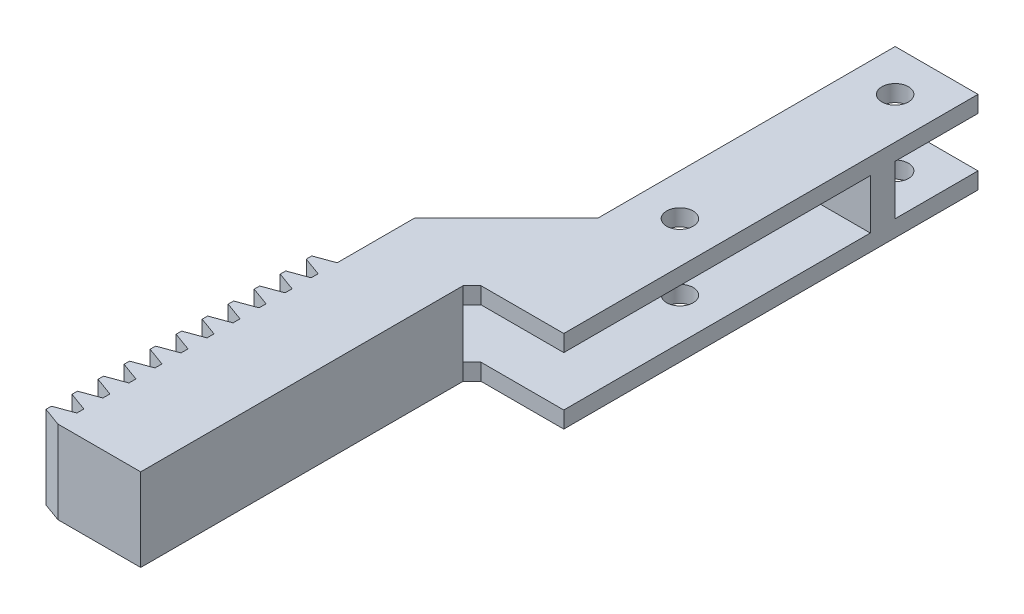
from build123d import *

# Parameters (mm, degrees)
SKETCH_1_W             = 10
SKETCH_1_H             = 50
EXTRUDE_1_DEPTH        = 2
CUT_EXTRUDE_1_REACH    = 27.573
SKETCH_2_R             = 1.6
EXTRUDE_5_DEPTH        = 2
SKETCH_4_W             = 10
SKETCH_4_H             = 3
EXTRUDE_2_DEPTH        = 6
EXTRUDE_START          = 2
SKETCH_5_R             = 1.6
EXTRUDE_3_DEPTH        = 2
EXTRUDE_4_DEPTH        = 10
PATTERN_LINEAR_1_COUNT = 11
PATTERN_LINEAR_1_PITCH = 3.141592654


with BuildPart() as part:
    # 草图1 → 凸台-拉伸1 (new body)
    with BuildSketch(Plane(origin=(0, 0, 0), x_dir=(1, 0, 0), z_dir=(0, 1, 0))):
        Rectangle(SKETCH_1_W, SKETCH_1_H)
    extrude(amount=EXTRUDE_1_DEPTH)

    # 草图2 → 切除-拉伸1 (cut, up to next)
    with BuildSketch(Plane(origin=(0, 2, 0), x_dir=(1, 0, 0), z_dir=(0, 1, 0)), mode=Mode.PRIVATE) as cut_extrude_1_sk1:
        with Locations(Location((0, 20, 0), (0, 0, 270))):
            Circle(SKETCH_2_R)
    cut_extrude_1_tool1 = extrude(cut_extrude_1_sk1.sketch, amount=-CUT_EXTRUDE_1_REACH, mode=Mode.PRIVATE) & part.part
    # 草图2 → 切除-拉伸1 (cut, up to next)
    with BuildSketch(Plane(origin=(0, 2, 0), x_dir=(1, 0, 0), z_dir=(0, 1, 0)), mode=Mode.PRIVATE) as cut_extrude_1_sk2:
        with Locations(Location((0, -5.98075, 0), (0, 0, 270))):
            Circle(SKETCH_2_R)
    cut_extrude_1_tool2 = extrude(cut_extrude_1_sk2.sketch, amount=-CUT_EXTRUDE_1_REACH, mode=Mode.PRIVATE) & part.part
    add(cut_extrude_1_tool1.solids().sort_by_distance((0, 2, -20))[0], mode=Mode.SUBTRACT)
    add(cut_extrude_1_tool2.solids().sort_by_distance((0, 2, 5.98075))[0], mode=Mode.SUBTRACT)

    # 草图8 → 凸台-拉伸5 (add)
    with BuildSketch(Plane(origin=(0, 2, 0), x_dir=(1, 0, 0), z_dir=(0, 1, 0))):
        Polygon((-5, -25), (-6.07, -26.07), (-6.07, -65), (-16.07, -65), (-16.07, -21.927864376), (-5, -10.857864376), align=None)
    extrude(amount=-EXTRUDE_5_DEPTH)

    # 草图4 → 凸台-拉伸2 (add)
    with BuildSketch(Plane(origin=(0, 2, 0), x_dir=(1, 0, 0), z_dir=(0, 1, 0))):
        with Locations((0, 13.5)):
            Rectangle(SKETCH_4_W, SKETCH_4_H)
        Polygon((-6.07, -26.07), (-13.141067812, -18.998932188), (-16.07, -21.927864376), (-16.07, -65), (-6.07, -65), align=None)
    extrude(amount=EXTRUDE_2_DEPTH)

    # 草图5 → 凸台-拉伸3 (add)
    with BuildSketch(Plane(origin=(0, 8, 0), x_dir=(1, 0, 0), z_dir=(0, 1, 0)).offset(EXTRUDE_START)):
        Polygon((-5, 25), (-5, -10.857864376), (-16.07, -21.927864376), (-16.07, -65), (-6.07, -65), (-6.07, -26.07), (-5, -25), (5, -25), (5, 25), align=None)
        with Locations(Location((0, -5.98075, 0), (0, 0, 270))):
            Circle(SKETCH_5_R, mode=Mode.SUBTRACT)
        with Locations(Location((0, 20, 0), (0, 0, 270))):
            Circle(SKETCH_5_R, mode=Mode.SUBTRACT)
    extrude(amount=-EXTRUDE_3_DEPTH)

    # 草图7 → 凸台-拉伸4 (add)
    with BuildSketch(Plane(origin=(0, 10, 0), x_dir=(1, 0, 0), z_dir=(0, 1, 0))):
        Polygon((-16.07, -65), (-18.32, -64.181066973), (-18.32, -63.520196234), (-16.07, -62.701263206), align=None)
    extrude_4 = extrude(amount=-EXTRUDE_4_DEPTH)

    # 阵列(线性)1: 凸台-拉伸4 ×11
    with Locations(*[(0, 0, -i * PATTERN_LINEAR_1_PITCH) for i in range(1, PATTERN_LINEAR_1_COUNT)]):
        add(extrude_4)


solid = part.part
